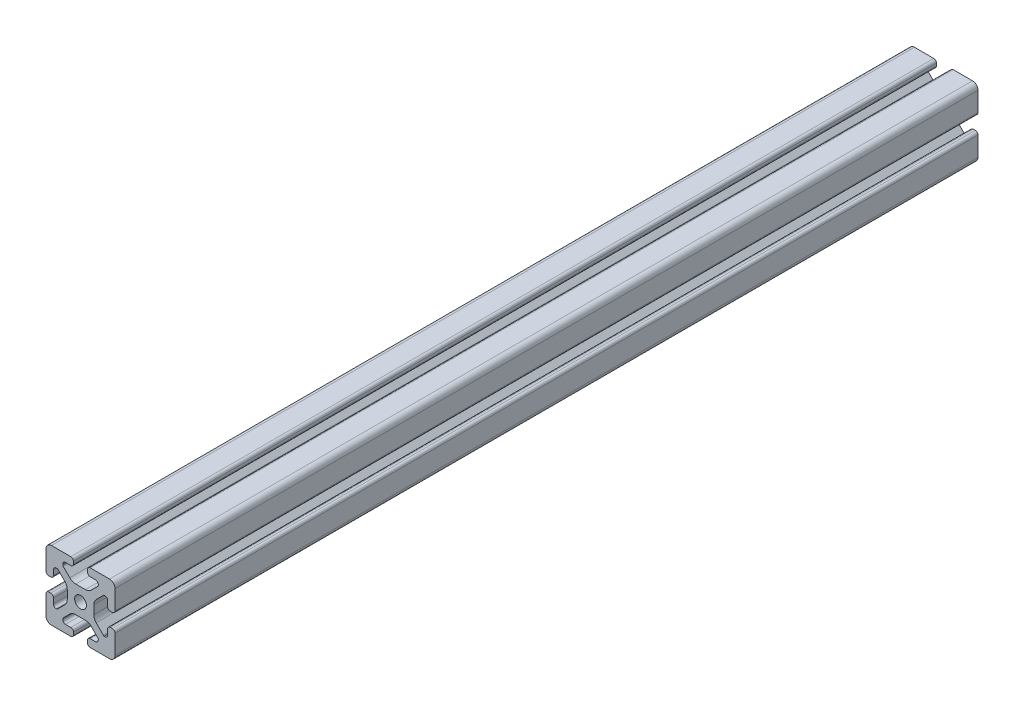
from build123d import *

# Parameters (mm, degrees)
SKETCH1_R           = 3.4
BOSS_EXTRUDE2_DEPTH = 500


with BuildPart() as part:
    # Sketch1 → Boss-Extrude2 (new body)
    with BuildSketch(Plane.XY):
        with BuildLine():
            Line((-8.715, -15.524615034), (-5.63, -15.524615034))
            ThreePointArc((-5.63, -15.524615034), (-4.519842354, -15.984457388), (-4.06, -17.094615034))
            Line((-4.06, -17.094615034), (-4.06, -18.43))
            ThreePointArc((-4.06, -18.43), (-4.519842354, -19.540157646), (-5.63, -20))
            Line((-5.63, -20), (-16.674615034, -20))
            ThreePointArc((-16.674615034, -20), (-18.951578385, -19.194274381), (-20, -17.018368134))
            Line((-20, -17.018368134), (-20, -5.757918808))
            ThreePointArc((-20, -5.757918808), (-19.564709668, -4.603883664), (-18.43, -4.120449326))
            Line((-18.43, -4.120449326), (-17.248545805, -4.120449326))
            ThreePointArc((-17.248545805, -4.120449326), (-16.114784845, -4.604407881), (-15.67999625, -5.757919334))
            Line((-15.67999625, -5.757919334), (-15.67999625, -8.715399492))
            ThreePointArc((-15.67999625, -8.715399492), (-15.220153896, -9.825557139), (-14.10999625, -10.285399492))
            Line((-14.10999625, -10.285399492), (-13.816903094, -10.285399492))
            ThreePointArc((-13.816903094, -10.285399492), (-13.526063686, -10.227547937), (-13.279501941, -10.062800646))
            Line((-13.279501941, -10.062800646), (-9.076242789, -5.859541495))
            ThreePointArc((-9.076242789, -5.859541495), (-8.046572221, -4.318530588), (-7.685, -2.500784284))
            Line((-7.685, -2.500784284), (-7.685, 2.500784284))
            ThreePointArc((-7.685, 2.500784284), (-8.046572221, 4.318530588), (-9.076242789, 5.859541495))
            Line((-9.076242789, 5.859541495), (-13.040489136, 9.823787841))
            ThreePointArc((-13.040489136, 9.823787841), (-13.354224618, 10.012729352), (-13.71989919, 10.033001362))
            Line((-13.71989919, 10.033001362), (-14.05520779, 10.044710596))
            ThreePointArc((-14.05520779, 10.044710596), (-15.200613642, 9.605030484), (-15.68, 8.475666998))
            Line((-15.68, 8.475666998), (-15.68, 5.572979049))
            ThreePointArc((-15.68, 5.572979049), (-16.139842354, 4.462821403), (-17.25, 4.002979049))
            Line((-17.25, 4.002979049), (-18.43, 4.002979049))
            ThreePointArc((-18.43, 4.002979049), (-19.540157646, 4.462821403), (-20, 5.572979049))
            Line((-20, 5.572979049), (-20, 13.004526564))
            Line((-20, 13.004526564), (-20, 16.83))
            ThreePointArc((-20, 16.83), (-19.071528496, 19.071528496), (-16.83, 20))
            Line((-16.83, 20), (-5.63, 20))
            ThreePointArc((-5.63, 20), (-4.519842354, 19.540157646), (-4.06, 18.43))
            Line((-4.06, 18.43), (-4.06, 17.094615034))
            ThreePointArc((-4.06, 17.094615034), (-4.519842354, 15.984457388), (-5.63, 15.524615034))
            Line((-5.63, 15.524615034), (-8.715, 15.524615034))
            ThreePointArc((-8.715, 15.524615034), (-9.825157646, 15.06477268), (-10.285, 13.954615034))
            Line((-10.285, 13.954615034), (-10.285, 13.492503602))
            ThreePointArc((-10.285, 13.492503602), (-10.227148445, 13.201664194), (-10.062401154, 12.955102448))
            Line((-10.062401154, 12.955102448), (-6.217092793, 9.109794088))
            ThreePointArc((-6.217092793, 9.109794088), (-4.63891877, 8.055291919), (-2.777335583, 7.685))
            Line((-2.777335583, 7.685), (2.777335583, 7.685))
            ThreePointArc((2.777335583, 7.685), (4.63891877, 8.055291919), (6.217092793, 9.109794088))
            Line((6.217092793, 9.109794088), (10.062401154, 12.955102448))
            ThreePointArc((10.062401154, 12.955102448), (10.227148445, 13.201664194), (10.285, 13.492503602))
            Line((10.285, 13.492503602), (10.285, 13.954615034))
            ThreePointArc((10.285, 13.954615034), (9.825157646, 15.06477268), (8.715, 15.524615034))
            Line((8.715, 15.524615034), (5.63, 15.524615034))
            ThreePointArc((5.63, 15.524615034), (4.519842354, 15.984457388), (4.06, 17.094615034))
            Line((4.06, 17.094615034), (4.06, 18.43))
            ThreePointArc((4.06, 18.43), (4.519842354, 19.540157646), (5.63, 20))
            Line((5.63, 20), (12.979635074, 20))
            Line((12.979635074, 20), (16.83, 20))
            ThreePointArc((16.83, 20), (19.071528496, 19.071528496), (20, 16.83))
            Line((20, 16.83), (20, 13.001098436))
            Line((20, 13.001098436), (20, 5.630000526))
            ThreePointArc((20, 5.630000526), (19.540157646, 4.519842879), (18.43, 4.060000526))
            Line((18.43, 4.060000526), (17.24999625, 4.060000526))
            ThreePointArc((17.24999625, 4.060000526), (16.139838603, 4.519842879), (15.67999625, 5.630000526))
            Line((15.67999625, 5.630000526), (15.67999625, 8.715399492))
            ThreePointArc((15.67999625, 8.715399492), (15.220153896, 9.825557139), (14.10999625, 10.285399492))
            Line((14.10999625, 10.285399492), (13.816903094, 10.285399492))
            ThreePointArc((13.816903094, 10.285399492), (13.526063686, 10.227547937), (13.279501941, 10.062800646))
            Line((13.279501941, 10.062800646), (9.076242789, 5.859541495))
            ThreePointArc((9.076242789, 5.859541495), (8.046572221, 4.318530588), (7.685, 2.500784284))
            Line((7.685, 2.500784284), (7.685, -2.500784284))
            ThreePointArc((7.685, -2.500784284), (8.046572221, -4.318530588), (9.076242789, -5.859541495))
            Line((9.076242789, -5.859541495), (13.163657296, -9.946956002))
            ThreePointArc((13.163657296, -9.946956002), (13.35903797, -10.160433474), (13.6200547, -10.285399492))
            Line((13.6200547, -10.285399492), (14.10999625, -10.285399492))
            ThreePointArc((14.10999625, -10.285399492), (15.220153896, -9.825557139), (15.67999625, -8.715399492))
            Line((15.67999625, -8.715399492), (15.67999625, -5.630000526))
            ThreePointArc((15.67999625, -5.630000526), (16.139838603, -4.519842879), (17.24999625, -4.060000526))
            Line((17.24999625, -4.060000526), (18.43, -4.060000526))
            ThreePointArc((18.43, -4.060000526), (19.540157646, -4.519842879), (20, -5.630000526))
            Line((20, -5.630000526), (20, -16.83))
            ThreePointArc((20, -16.83), (19.071528496, -19.071528496), (16.83, -20))
            Line((16.83, -20), (13, -20))
            Line((13, -20), (5.63, -20))
            ThreePointArc((5.63, -20), (4.519842354, -19.540157646), (4.06, -18.43))
            Line((4.06, -18.43), (4.06, -17.094615034))
            ThreePointArc((4.06, -17.094615034), (4.519842354, -15.984457388), (5.63, -15.524615034))
            Line((5.63, -15.524615034), (8.715, -15.524615034))
            ThreePointArc((8.715, -15.524615034), (9.825157646, -15.06477268), (10.285, -13.954615034))
            Line((10.285, -13.954615034), (10.285, -13.492503602))
            ThreePointArc((10.285, -13.492503602), (10.227148445, -13.201664194), (10.062401154, -12.955102448))
            Line((10.062401154, -12.955102448), (6.217092793, -9.109794088))
            ThreePointArc((6.217092793, -9.109794088), (4.63891877, -8.055291919), (2.777335583, -7.685))
            Line((2.777335583, -7.685), (-2.777335583, -7.685))
            ThreePointArc((-2.777335583, -7.685), (-4.63891877, -8.055291919), (-6.217092793, -9.109794088))
            Line((-6.217092793, -9.109794088), (-10.062401154, -12.955102448))
            ThreePointArc((-10.062401154, -12.955102448), (-10.227148445, -13.201664194), (-10.285, -13.492503602))
            Line((-10.285, -13.492503602), (-10.285, -13.954615034))
            ThreePointArc((-10.285, -13.954615034), (-9.825157646, -15.06477268), (-8.715, -15.524615034))
        make_face()
        Circle(SKETCH1_R, mode=Mode.SUBTRACT)
    extrude(amount=BOSS_EXTRUDE2_DEPTH)


solid = part.part
